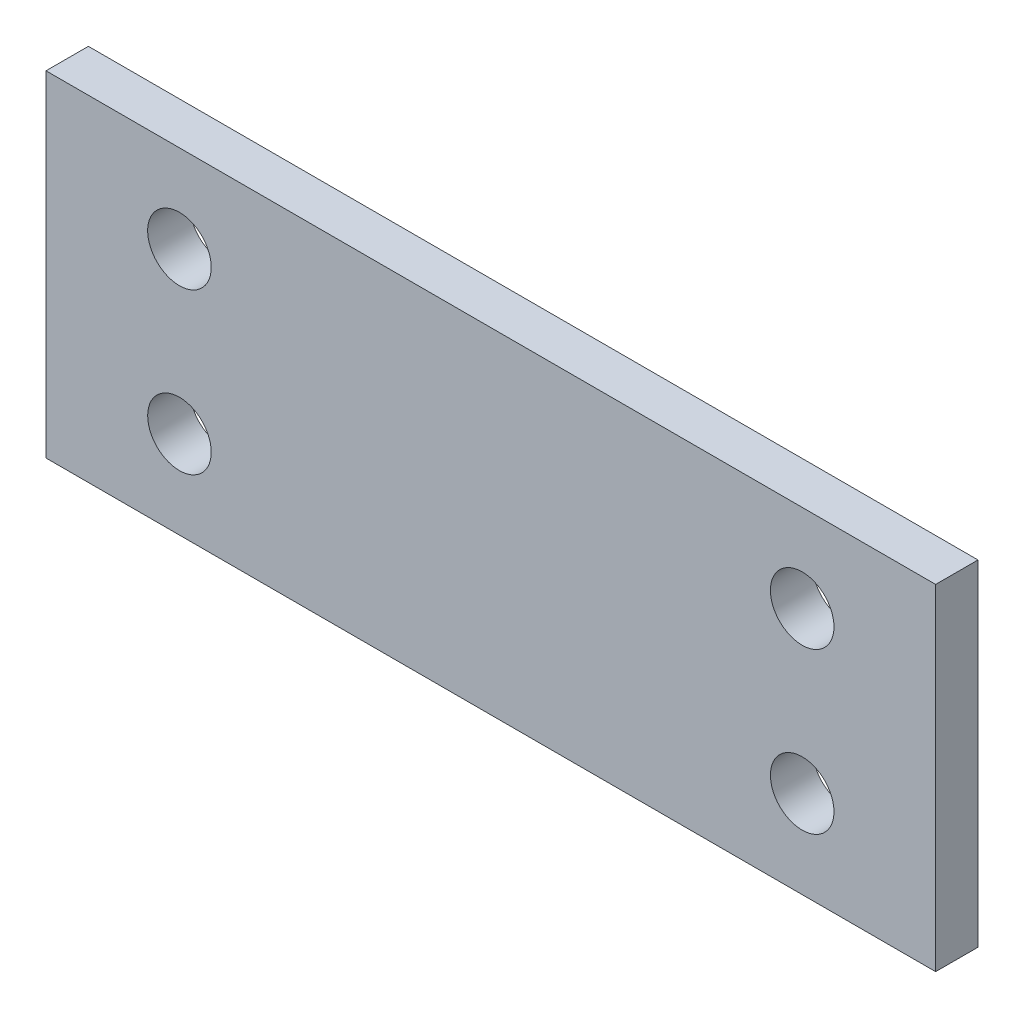
from build123d import *

# Parameters (mm, degrees)
CROQUIS1_W              = 200
CROQUIS1_H              = 75.4
SALIENTE_EXTRUIR1_DEPTH = 9.525
CROQUIS2_R              = 7.14375
CORTAR_EXTRUIR1_DEPTH   = 10


with BuildPart() as part:
    # Croquis1 → Saliente-Extruir1 (new body)
    with BuildSketch(Plane.XY):
        with Locations((0, -12.3)):
            Rectangle(CROQUIS1_W, CROQUIS1_H)
    extrude(amount=SALIENTE_EXTRUIR1_DEPTH)

    # Croquis2 → Cortar-Extruir1 (cut)
    with BuildSketch(Plane.XY.offset(9.525)):
        with Locations((-70, 5.7)):
            Circle(CROQUIS2_R)
        with Locations((-70, -30.3)):
            Circle(CROQUIS2_R)
        with Locations((70, -30.3)):
            Circle(CROQUIS2_R)
        with Locations((70, 5.7)):
            Circle(CROQUIS2_R)
    extrude(amount=-CORTAR_EXTRUIR1_DEPTH, mode=Mode.SUBTRACT)


solid = part.part
